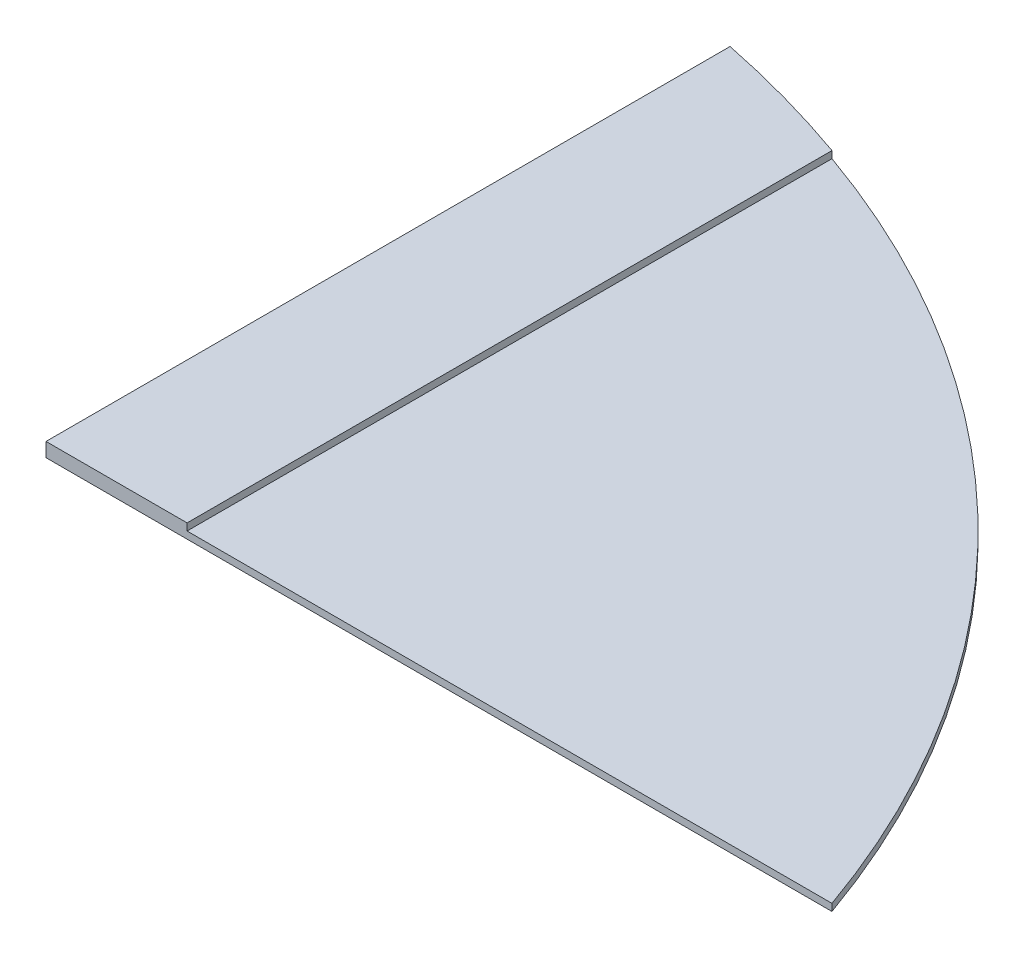
from build123d import *

# Parameters (mm, degrees)
BOSS_EXTRUDE3_DEPTH = 1
BOSS_EXTRUDE4_DEPTH = 1
CUT_EXTRUDE1_DEPTH  = 208.84850252


with BuildPart() as part:
    # Sketch1 → Boss-Extrude3 (new body)
    with BuildSketch(Plane(origin=(0, 0, 0), x_dir=(1, 0, 0), z_dir=(0, 1, 0))):
        with BuildLine():
            Line((50, 50), (50, 30))
            Line((50, 30), (146.969384567, 30))
            ThreePointArc((146.969384567, 30), (106.066017178, 106.066017178), (30, 146.969384567))
            Line((30, 146.969384567), (30, 50))
            Line((30, 50), (50, 50))
        make_face()
    extrude(amount=BOSS_EXTRUDE3_DEPTH)

    # Sketch2 → Boss-Extrude4 (add)
    with BuildSketch(Plane(origin=(0, 1, 0), x_dir=(-1, 0, 0), z_dir=(0, 1, 0))):
        with BuildLine():
            Line((-50, -50), (-30, -50))
            Line((-30, -50), (-30, -146.969384567))
            ThreePointArc((-30, -146.969384567), (-40.096074055, -144.541706249), (-50, -141.421356237))
            Line((-50, -141.421356237), (-50, -50))
        make_face()
    extrude(amount=BOSS_EXTRUDE4_DEPTH)

    # Sketch3 → Cut-Extrude1 (cut, through all)
    with BuildSketch(Plane(origin=(0, 1, 0), x_dir=(-1, 0, 0), z_dir=(0, 1, 0))):
        with BuildLine():
            Line((-141.421356237, -50), (-50, -50))
            Line((-50, -50), (-50, -30))
            Line((-50, -30), (-146.969384567, -30))
            ThreePointArc((-146.969384567, -30), (-144.541706249, -40.096074055), (-141.421356237, -50))
        make_face()
    extrude(amount=-CUT_EXTRUDE1_DEPTH, mode=Mode.SUBTRACT)


solid = part.part
